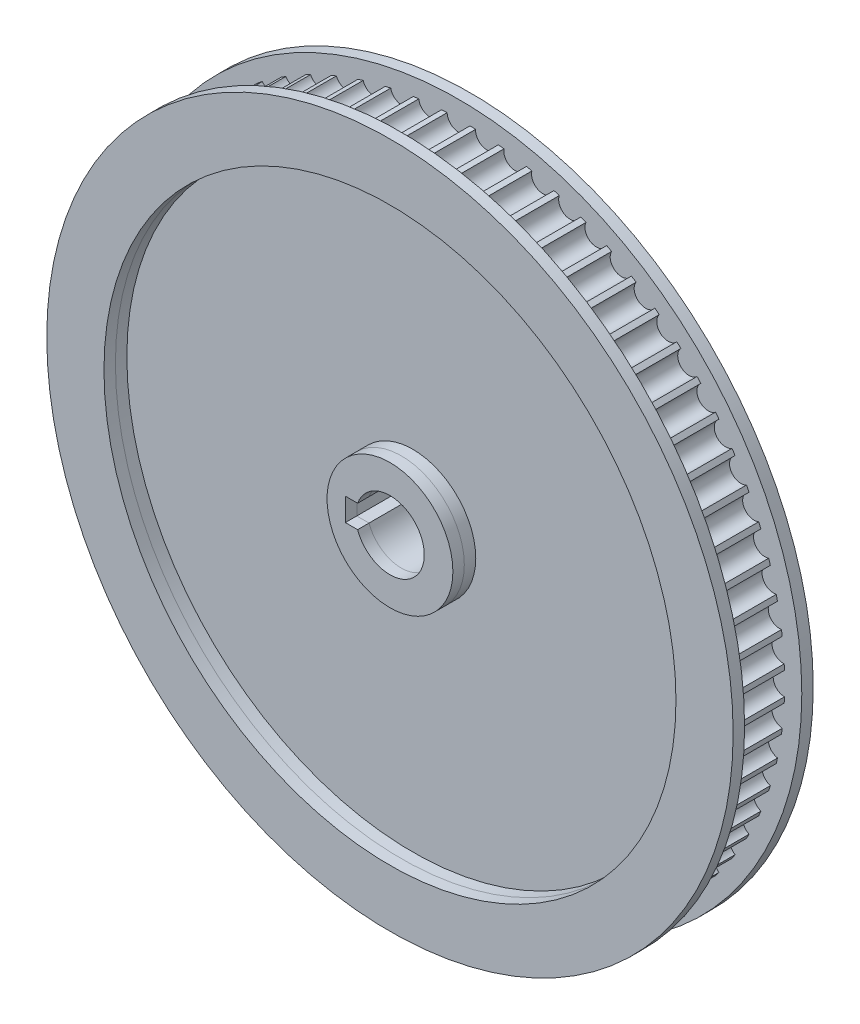
from build123d import *

# Parameters (mm, degrees)
SKETCH1_R           = 57
BOSS_EXTRUDE1_DEPTH = 10
CUT_EXTRUDE4_REACH  = 83.228
SKETCH5_R           = 6
KEYWAY_DEPTH        = 98.331318213
SKETCH8_R           = 50
SKETCH8_R_2         = 11
CUT_EXTRUDE6_DEPTH  = 2
CUT_EXTRUDE7_START  = -2
SKETCH9_R           = 50
SKETCH9_R_2         = 11
CUT_EXTRUDE7_DEPTH  = 2
BOSS_EXTRUDE2_START = 2
SKETCH11_R          = 60
SKETCH11_R_2        = 57
SKETCH11_R_3        = 50
SKETCH11_R_4        = 11
BOSS_EXTRUDE2_DEPTH = 2
SKETCH12_R          = 60
SKETCH12_R_2        = 57
SKETCH12_R_3        = 50
SKETCH12_R_4        = 11
BOSS_EXTRUDE3_DEPTH = 2
SKETCH10_R          = 2
CUT_EXTRUDE8_DEPTH  = 5


with BuildPart() as part:
    # Sketch1 → Boss-Extrude1 (new body)
    with BuildSketch(Plane.XY):
        Circle(SKETCH1_R)
    extrude(amount=BOSS_EXTRUDE1_DEPTH)

    # Sketch5 → Cut-Extrude4 (cut, up to next)
    with BuildSketch(Plane.XY.offset(10), mode=Mode.PRIVATE) as cut_extrude4_sk1:
        Circle(SKETCH5_R)
    cut_extrude4_tool1 = extrude(cut_extrude4_sk1.sketch, amount=-CUT_EXTRUDE4_REACH, mode=Mode.PRIVATE) & part.part
    add(cut_extrude4_tool1.solids().sort_by_distance((0, 0, 10))[0], mode=Mode.SUBTRACT)

    # KeySketch → Keyway (cut, through all)
    with BuildSketch(Plane(origin=(-8.629402249, -14.177012199, 10), x_dir=(1, 0, 0), z_dir=(0, 0, 1))):
        with BuildLine():
            Line((2.972547999, 12.177012199), (0.829402249, 12.177012199))
            Line((0.829402249, 12.177012199), (0.829402249, 16.177012199))
            Line((0.829402249, 16.177012199), (2.972547999, 16.177012199))
            ThreePointArc((2.972547999, 16.177012199), (14.629402249, 14.177012199), (2.972547999, 12.177012199))
        make_face()
    extrude(amount=-KEYWAY_DEPTH, mode=Mode.SUBTRACT)

    # Sketch8 → Cut-Extrude6 (cut)
    with BuildSketch(Plane(origin=(0, 0, 0), x_dir=(-1, 0, 0), z_dir=(0, 0, -1))):
        Circle(SKETCH8_R)
        Circle(SKETCH8_R_2, mode=Mode.SUBTRACT)
    extrude(amount=-CUT_EXTRUDE6_DEPTH, mode=Mode.SUBTRACT)

    # Sketch9 → Cut-Extrude7 (cut)
    with BuildSketch(Plane.XY.offset(10).offset(CUT_EXTRUDE7_START)):
        with Locations(Location((0, 0, 0), (0, 0, 180))):
            Circle(SKETCH9_R)
        with Locations(Location((0, 0, 0), (0, 0, 180))):
            Circle(SKETCH9_R_2, mode=Mode.SUBTRACT)
    extrude(amount=CUT_EXTRUDE7_DEPTH, mode=Mode.SUBTRACT)

    # Sketch11 → Boss-Extrude2 (add)
    # profile 1 of 3: a face of its own
    with BuildSketch(Plane(origin=(0, 0, 0), x_dir=(-1, 0, 0), z_dir=(0, 0, -1)).offset(BOSS_EXTRUDE2_START)):
        Circle(SKETCH11_R)
        with Locations(Location((0, 0, 0), (0, 0, 180))):
            Circle(SKETCH11_R_2, mode=Mode.SUBTRACT)
    # profile 2 of 3: a face of its own
    with BuildSketch(Plane(origin=(0, 0, 0), x_dir=(-1, 0, 0), z_dir=(0, 0, -1)).offset(BOSS_EXTRUDE2_START)):
        with Locations(Location((0, 0, 0), (0, 0, 180))):
            Circle(SKETCH11_R_2)
        Circle(SKETCH11_R_3, mode=Mode.SUBTRACT)
    # profile 3 of 3: a face of its own
    with BuildSketch(Plane(origin=(0, 0, 0), x_dir=(-1, 0, 0), z_dir=(0, 0, -1)).offset(BOSS_EXTRUDE2_START)):
        Circle(SKETCH11_R_4)
        with BuildLine():
            ThreePointArc((5.656854249, 2), (-6, 0), (5.656854249, -2))
            Line((5.656854249, -2), (7.8, -2))
            Line((7.8, -2), (7.8, 2))
            Line((7.8, 2), (5.656854249, 2))
        make_face(mode=Mode.SUBTRACT)
    extrude(amount=-BOSS_EXTRUDE2_DEPTH)

    # Sketch10 → Cut-Extrude8 (cut, symmetric)
    with BuildSketch(Plane.XY.offset(5)):
        with Locations((0, 57)):
            Circle(SKETCH10_R)
        with Locations((4.967877337, 56.783097791)):
            Circle(SKETCH10_R)
        with Locations((9.897946127, 56.134041922)):
            Circle(SKETCH10_R)
        with Locations((14.752685571, 55.057772098)):
            Circle(SKETCH10_R)
        with Locations((19.49514817, 53.562479385)):
            Circle(SKETCH10_R)
        with Locations((24.089240919, 51.659543861)):
            Circle(SKETCH10_R)
        with Locations((28.5, 49.363448016)):
            Circle(SKETCH10_R)
        with Locations((32.693856872, 46.691666524)):
            Circle(SKETCH10_R)
        with Locations((36.638893752, 43.664533258)):
            Circle(SKETCH10_R)
        with Locations((40.305086528, 40.305086528)):
            Circle(SKETCH10_R)
        with Locations((43.664533258, 36.638893752)):
            Circle(SKETCH10_R)
        with Locations((46.691666524, 32.693856872)):
            Circle(SKETCH10_R)
        with Locations((49.363448016, 28.5)):
            Circle(SKETCH10_R)
        with Locations((51.659543861, 24.089240919)):
            Circle(SKETCH10_R)
        with Locations((53.562479385, 19.49514817)):
            Circle(SKETCH10_R)
        with Locations((55.057772098, 14.752685571)):
            Circle(SKETCH10_R)
        with Locations((56.134041922, 9.897946127)):
            Circle(SKETCH10_R)
        with Locations((56.783097791, 4.967877337)):
            Circle(SKETCH10_R)
        with Locations((57, 0)):
            Circle(SKETCH10_R)
        with Locations((56.783097791, -4.967877337)):
            Circle(SKETCH10_R)
        with Locations((56.134041922, -9.897946127)):
            Circle(SKETCH10_R)
        with Locations((55.057772098, -14.752685571)):
            Circle(SKETCH10_R)
        with Locations((53.562479385, -19.49514817)):
            Circle(SKETCH10_R)
        with Locations((51.659543861, -24.089240919)):
            Circle(SKETCH10_R)
        with Locations((49.363448016, -28.5)):
            Circle(SKETCH10_R)
        with Locations((46.691666524, -32.693856872)):
            Circle(SKETCH10_R)
        with Locations((43.664533258, -36.638893752)):
            Circle(SKETCH10_R)
        with Locations((40.305086528, -40.305086528)):
            Circle(SKETCH10_R)
        with Locations((36.638893752, -43.664533258)):
            Circle(SKETCH10_R)
        with Locations((32.693856872, -46.691666524)):
            Circle(SKETCH10_R)
        with Locations((28.5, -49.363448016)):
            Circle(SKETCH10_R)
        with Locations((24.089240919, -51.659543861)):
            Circle(SKETCH10_R)
        with Locations((19.49514817, -53.562479385)):
            Circle(SKETCH10_R)
        with Locations((14.752685571, -55.057772098)):
            Circle(SKETCH10_R)
        with Locations((9.897946127, -56.134041922)):
            Circle(SKETCH10_R)
        with Locations((4.967877337, -56.783097791)):
            Circle(SKETCH10_R)
        with Locations((0, -57)):
            Circle(SKETCH10_R)
        with Locations((-4.967877337, -56.783097791)):
            Circle(SKETCH10_R)
        with Locations((-9.897946127, -56.134041922)):
            Circle(SKETCH10_R)
        with Locations((-14.752685571, -55.057772098)):
            Circle(SKETCH10_R)
        with Locations((-19.49514817, -53.562479385)):
            Circle(SKETCH10_R)
        with Locations((-24.089240919, -51.659543861)):
            Circle(SKETCH10_R)
        with Locations((-28.5, -49.363448016)):
            Circle(SKETCH10_R)
        with Locations((-32.693856872, -46.691666524)):
            Circle(SKETCH10_R)
        with Locations((-36.638893752, -43.664533258)):
            Circle(SKETCH10_R)
        with Locations((-40.305086528, -40.305086528)):
            Circle(SKETCH10_R)
        with Locations((-43.664533258, -36.638893752)):
            Circle(SKETCH10_R)
        with Locations((-46.691666524, -32.693856872)):
            Circle(SKETCH10_R)
        with Locations((-49.363448016, -28.5)):
            Circle(SKETCH10_R)
        with Locations((-51.659543861, -24.089240919)):
            Circle(SKETCH10_R)
        with Locations((-53.562479385, -19.49514817)):
            Circle(SKETCH10_R)
        with Locations((-55.057772098, -14.752685571)):
            Circle(SKETCH10_R)
        with Locations((-56.134041922, -9.897946127)):
            Circle(SKETCH10_R)
        with Locations((-56.783097791, -4.967877337)):
            Circle(SKETCH10_R)
        with Locations((-57, 0)):
            Circle(SKETCH10_R)
        with Locations((-56.783097791, 4.967877337)):
            Circle(SKETCH10_R)
        with Locations((-56.134041922, 9.897946127)):
            Circle(SKETCH10_R)
        with Locations((-55.057772098, 14.752685571)):
            Circle(SKETCH10_R)
        with Locations((-53.562479385, 19.49514817)):
            Circle(SKETCH10_R)
        with Locations((-51.659543861, 24.089240919)):
            Circle(SKETCH10_R)
        with Locations((-49.363448016, 28.5)):
            Circle(SKETCH10_R)
        with Locations((-46.691666524, 32.693856872)):
            Circle(SKETCH10_R)
        with Locations((-43.664533258, 36.638893752)):
            Circle(SKETCH10_R)
        with Locations((-40.305086528, 40.305086528)):
            Circle(SKETCH10_R)
        with Locations((-36.638893752, 43.664533258)):
            Circle(SKETCH10_R)
        with Locations((-32.693856872, 46.691666524)):
            Circle(SKETCH10_R)
        with Locations((-28.5, 49.363448016)):
            Circle(SKETCH10_R)
        with Locations((-24.089240919, 51.659543861)):
            Circle(SKETCH10_R)
        with Locations((-19.49514817, 53.562479385)):
            Circle(SKETCH10_R)
        with Locations((-14.752685571, 55.057772098)):
            Circle(SKETCH10_R)
        with Locations((-9.897946127, 56.134041922)):
            Circle(SKETCH10_R)
        with Locations((-4.967877337, 56.783097791)):
            Circle(SKETCH10_R)
    extrude(amount=CUT_EXTRUDE8_DEPTH, both=True, mode=Mode.SUBTRACT)


with BuildPart() as body_2:
    # Sketch12 → Boss-Extrude3 (new body)
    # profile 1 of 3: a face of its own
    with BuildSketch(Plane.XY.offset(10)):
        Circle(SKETCH12_R)
        Circle(SKETCH12_R_2, mode=Mode.SUBTRACT)
    # profile 2 of 3: a face of its own
    with BuildSketch(Plane.XY.offset(10)):
        Circle(SKETCH12_R_2)
        Circle(SKETCH12_R_3, mode=Mode.SUBTRACT)
    # profile 3 of 3: a face of its own
    with BuildSketch(Plane.XY.offset(10)):
        Circle(SKETCH12_R_4)
        with BuildLine():
            ThreePointArc((-5.656854249, -2), (6, 0), (-5.656854249, 2))
            Line((-5.656854249, 2), (-7.8, 2))
            Line((-7.8, 2), (-7.8, -2))
            Line((-7.8, -2), (-5.656854249, -2))
        make_face(mode=Mode.SUBTRACT)
    extrude(amount=BOSS_EXTRUDE3_DEPTH)


solid = Compound([part.part, body_2.part])
